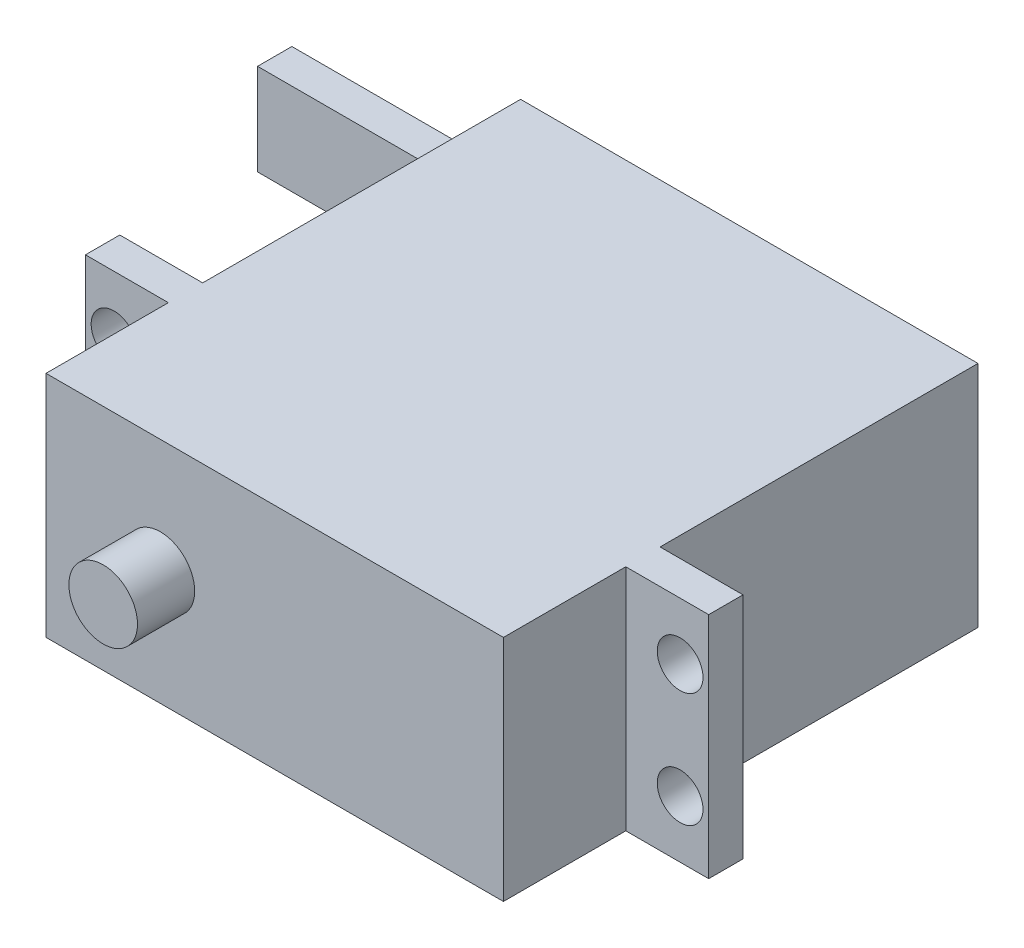
from build123d import *

# Parameters (mm, degrees)
SKETCH1_R           = 3
BOSS_EXTRUDE1_DEPTH = 2.5
SKETCH2_W           = 40
SKETCH2_H           = 20
BOSS_EXTRUDE2_DEPTH = 41.5
BOSS_EXTRUDE3_START = -27.8
SKETCH3_W           = 7.25
SKETCH3_H           = 20
BOSS_EXTRUDE3_DEPTH = 3
SKETCH4_R           = 2
CUT_EXTRUDE1_DEPTH  = 50.357902103
SKETCH5_W           = 3
SKETCH5_H           = 8
BOSS_EXTRUDE4_DEPTH = 20


with BuildPart() as part:
    # Sketch1 → Boss-Extrude1 (new, symmetric)
    with BuildSketch(Plane.XY):
        Circle(SKETCH1_R)
    extrude(amount=BOSS_EXTRUDE1_DEPTH, both=True)

    # Sketch2 → Boss-Extrude2 (add)
    with BuildSketch(Plane(origin=(0, 0, -2.5), x_dir=(-1, 0, 0), z_dir=(0, 0, -1))):
        with Locations((-10, 0)):
            Rectangle(SKETCH2_W, SKETCH2_H)
    extrude(amount=BOSS_EXTRUDE2_DEPTH)

    # Sketch3 → Boss-Extrude3 (add)
    with BuildSketch(Plane(origin=(0, 0, -44), x_dir=(-1, 0, 0), z_dir=(0, 0, -1)).offset(BOSS_EXTRUDE3_START)):
        with Locations((-33.625, 0)):
            Rectangle(SKETCH3_W, SKETCH3_H)
        with Locations((13.625, 0)):
            Rectangle(SKETCH3_W, SKETCH3_H)
    extrude(amount=-BOSS_EXTRUDE3_DEPTH)

    # Sketch4 → Cut-Extrude1 (cut, through all)
    with BuildSketch(Plane.XY.offset(-13.2)):
        with Locations((-14.75, -5)):
            Circle(SKETCH4_R)
        with Locations((-14.75, 5)):
            Circle(SKETCH4_R)
        with Locations((34.75, 5)):
            Circle(SKETCH4_R)
        with Locations((34.75, -5)):
            Circle(SKETCH4_R)
    extrude(amount=-CUT_EXTRUDE1_DEPTH, mode=Mode.SUBTRACT)

    # Sketch5 → Boss-Extrude4 (add)
    with BuildSketch(Plane.ZY.offset(10)):
        with Locations((-42.5, 0)):
            Rectangle(SKETCH5_W, SKETCH5_H)
    extrude(amount=BOSS_EXTRUDE4_DEPTH)


solid = part.part
